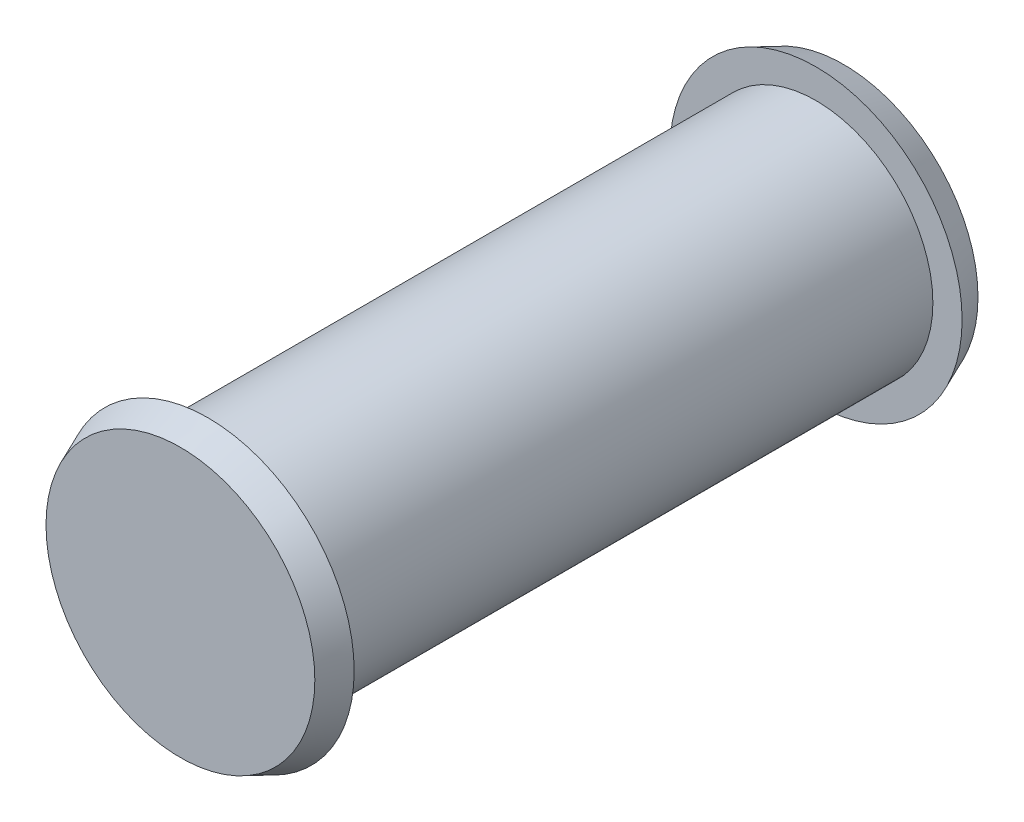
from build123d import *

# Parameters (mm, degrees)
SKETCH1_R      = 2.54
EXTRUDE1_DEPTH = 13.208
SKETCH2_R      = 3.175
EXTRUDE2_DEPTH = 0.6
EXTRUDE2_TAPER = 23
SKETCH3_R      = 3.175
EXTRUDE3_DEPTH = 0.6
EXTRUDE3_TAPER = 23


with BuildPart() as part:
    # Sketch1 → Extrude1 (new body)
    with BuildSketch(Plane.XY):
        with Locations((-108.082258725, 104.784469075)):
            Circle(SKETCH1_R)
    extrude(amount=-EXTRUDE1_DEPTH)

    # Sketch2 → Extrude2 (add)
    with BuildSketch(Plane.XY):
        with Locations((-108.082258725, 104.784469075)):
            Circle(SKETCH2_R)
    extrude(amount=EXTRUDE2_DEPTH, taper=EXTRUDE2_TAPER)

    # Sketch3 → Extrude3 (add)
    with BuildSketch(Plane(origin=(-216.039782036, 1.137132082, -13.208), x_dir=(-1, 0, 0), z_dir=(0, 0, -1))):
        with Locations((-107.957523311, 103.647336992)):
            Circle(SKETCH3_R)
    extrude(amount=EXTRUDE3_DEPTH, taper=EXTRUDE3_TAPER)


solid = part.part
